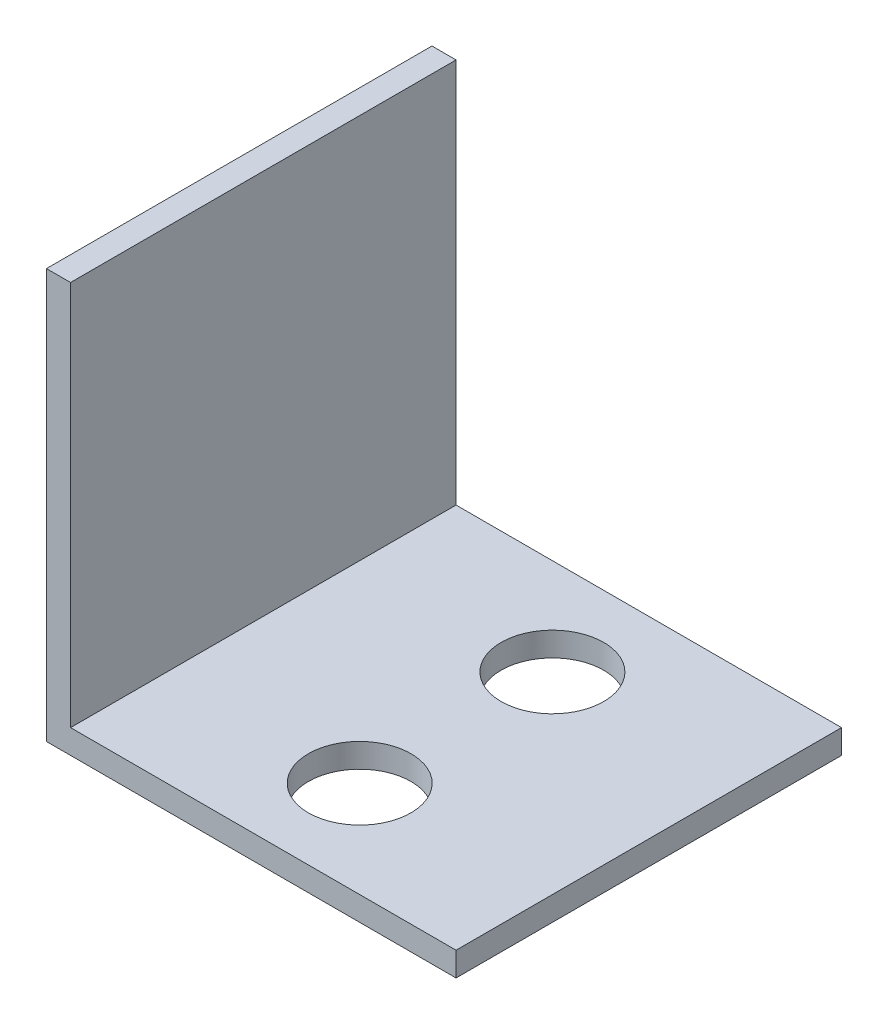
from build123d import *

# Parameters (mm, degrees)
BOSS_EXTRUDE1_DEPTH     = 25.4
F_1_4_CLEARANCE_HOLE1_D = 6.7564


with BuildPart() as part:
    # Sketch1 → Boss-Extrude1 (new body)
    with BuildSketch(Plane.XY):
        Polygon((0, 0), (0, 25.4), (-1.5875, 25.4), (-1.5875, -1.5875), (25.4, -1.5875), (25.4, 0), align=None)
    extrude(amount=BOSS_EXTRUDE1_DEPTH)

    # 1/4 Clearance Hole1 (through all)
    with Locations(Plane(origin=(12.7, 0, 19.05), x_dir=(1, 0, 0), z_dir=(0, 1, 0))):
        with Locations((0, 0), (0, 12.7)):
            Hole(F_1_4_CLEARANCE_HOLE1_D / 2)


solid = part.part
